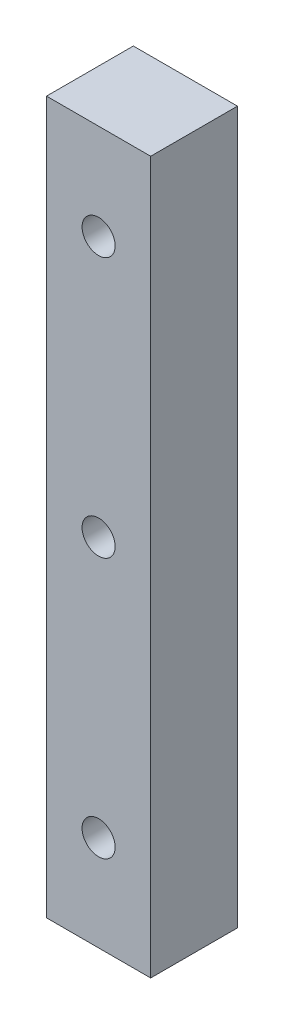
from build123d import *

# Parameters (mm, degrees)
SKETCH1_W           = 29.999999944
SKETCH1_H           = 25.000000038
BOSS_EXTRUDE1_DEPTH = 204.999999956
CUT_EXTRUDE1_REACH  = 210.686
SKETCH3_R           = 4.7625


with BuildPart() as part:
    # Sketch1 → Boss-Extrude1 (new body)
    with BuildSketch(Plane(origin=(0, 0, 0), x_dir=(-1, 0, 0), z_dir=(0, 1, 0))):
        with Locations((14.999999972, 12.500000019)):
            Rectangle(SKETCH1_W, SKETCH1_H)
    extrude(amount=BOSS_EXTRUDE1_DEPTH)

    # Sketch3 → Cut-Extrude1 (cut, up to next)
    with BuildSketch(Plane(origin=(0, 0, 0), x_dir=(1, 0, 0), z_dir=(0, 0, -1)), mode=Mode.PRIVATE) as cut_extrude1_sk1:
        with Locations(Location((-14.999999972, -102.499999978, 0), (0, 0, 180))):
            Circle(SKETCH3_R)
    cut_extrude1_tool1 = extrude(cut_extrude1_sk1.sketch, amount=-CUT_EXTRUDE1_REACH, mode=Mode.PRIVATE) & part.part
    # Sketch3 → Cut-Extrude1 (cut, up to next)
    with BuildSketch(Plane(origin=(0, 0, 0), x_dir=(1, 0, 0), z_dir=(0, 0, -1)), mode=Mode.PRIVATE) as cut_extrude1_sk2:
        with Locations(Location((-14.999999972, -27.499999991, 0), (0, 0, 180))):
            Circle(SKETCH3_R)
    cut_extrude1_tool2 = extrude(cut_extrude1_sk2.sketch, amount=-CUT_EXTRUDE1_REACH, mode=Mode.PRIVATE) & part.part
    # Sketch3 → Cut-Extrude1 (cut, up to next)
    with BuildSketch(Plane(origin=(0, 0, 0), x_dir=(1, 0, 0), z_dir=(0, 0, -1)), mode=Mode.PRIVATE) as cut_extrude1_sk3:
        with Locations(Location((-14.999999972, -177.499999965, 0), (0, 0, 180))):
            Circle(SKETCH3_R)
    cut_extrude1_tool3 = extrude(cut_extrude1_sk3.sketch, amount=-CUT_EXTRUDE1_REACH, mode=Mode.PRIVATE) & part.part
    add(cut_extrude1_tool1.solids().sort_by_distance((-15, 102.5, 0))[0], mode=Mode.SUBTRACT)
    add(cut_extrude1_tool2.solids().sort_by_distance((-15, 27.5, 0))[0], mode=Mode.SUBTRACT)
    add(cut_extrude1_tool3.solids().sort_by_distance((-15, 177.5, 0))[0], mode=Mode.SUBTRACT)


solid = part.part
